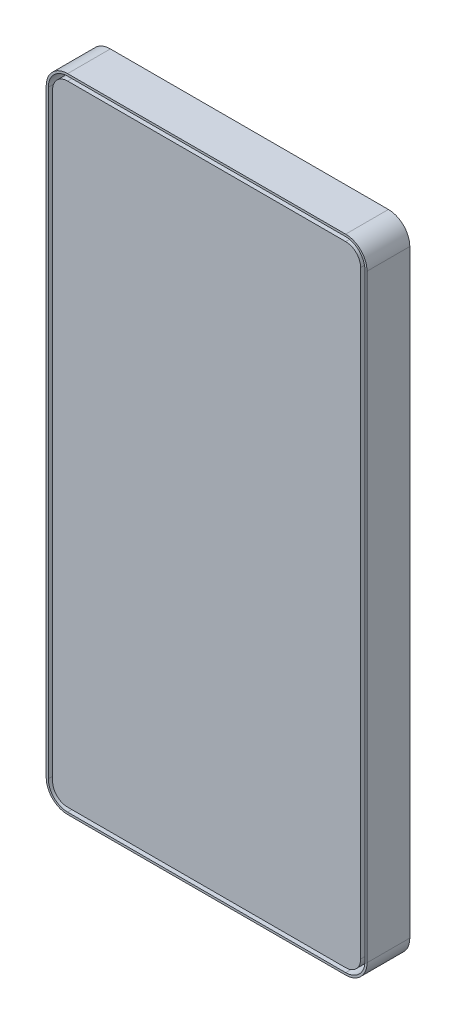
from build123d import *

# Parameters (mm, degrees)
EXTRUDE_1_DEPTH       = 10
EXTRUDE_2_DEPTH       = 3
CUT_EXTRUDE_1_DEPTH   = 1
CUT_EXTRUDE_1_2_DEPTH = 9
CUT_EXTRUDE_2_DEPTH   = 10
CUT_EXTRUDE_3_REACH   = 156.94


with BuildPart() as part:
    # 草图1 → 凸台-拉伸1 (new body)
    with BuildSketch(Plane.XY):
        with BuildLine():
            Line((-32.5, -75), (32.5, -75))
            ThreePointArc((32.5, -75), (36.035533906, -73.535533906), (37.5, -70))
            Line((37.5, -70), (37.5, 70))
            ThreePointArc((37.5, 70), (36.035533906, 73.535533906), (32.5, 75))
            Line((32.5, 75), (-32.5, 75))
            ThreePointArc((-32.5, 75), (-36.035533906, 73.535533906), (-37.5, 70))
            Line((-37.5, 70), (-37.5, -70))
            ThreePointArc((-37.5, -70), (-36.035533906, -73.535533906), (-32.5, -75))
        make_face()
    extrude(amount=EXTRUDE_1_DEPTH)

    # 草图2 → 凸台-拉伸2 (add)
    with BuildSketch(Plane(origin=(0, 0, 0), x_dir=(-1, 0, 0), z_dir=(0, 0, -1))):
        with BuildLine():
            Line((-29.5, 22), (10.5, 22))
            ThreePointArc((10.5, 22), (14.035533906, 23.464466094), (15.5, 27))
            Line((15.5, 27), (15.5, 67))
            ThreePointArc((15.5, 67), (14.035533906, 70.535533906), (10.5, 72))
            Line((10.5, 72), (-29.5, 72))
            ThreePointArc((-29.5, 72), (-33.035533906, 70.535533906), (-34.5, 67))
            Line((-34.5, 67), (-34.5, 27))
            ThreePointArc((-34.5, 27), (-33.035533906, 23.464466094), (-29.5, 22))
        make_face()
    extrude(amount=EXTRUDE_2_DEPTH)

    # 草图3 → Cut-Extrude 1 (cut)
    with BuildSketch(Plane(origin=(0, 0, -3), x_dir=(-1, 0, 0), z_dir=(0, 0, -1))):
        with BuildLine():
            Line((12.5, 27), (12.5, 67))
            ThreePointArc((12.5, 67), (11.914213562, 68.414213562), (10.5, 69))
            Line((10.5, 69), (-29.5, 69))
            ThreePointArc((-29.5, 69), (-30.914213562, 68.414213562), (-31.5, 67))
            Line((-31.5, 67), (-31.5, 27))
            ThreePointArc((-31.5, 27), (-30.914213562, 25.585786438), (-29.5, 25))
            Line((-29.5, 25), (10.5, 25))
            ThreePointArc((10.5, 25), (11.914213562, 25.585786438), (12.5, 27))
        make_face()
    extrude(amount=-CUT_EXTRUDE_1_DEPTH, mode=Mode.SUBTRACT)

    # 草图5 → Cut-Extrude 1 2 (cut)
    with BuildSketch(Plane.XY.offset(10)):
        with BuildLine():
            Line((-32.5, -74.5), (32.5, -74.5))
            ThreePointArc((32.5, -74.5), (35.681980515, -73.181980515), (37, -70))
            Line((37, -70), (37, 70))
            ThreePointArc((37, 70), (35.681980515, 73.181980515), (32.5, 74.5))
            Line((32.5, 74.5), (-32.5, 74.5))
            ThreePointArc((-32.5, 74.5), (-35.681980515, 73.181980515), (-37, 70))
            Line((-37, 70), (-37, -70))
            ThreePointArc((-37, -70), (-35.681980515, -73.181980515), (-32.5, -74.5))
        make_face()
        with BuildLine():
            Line((-32.5, -73.5), (32.5, -73.5))
            ThreePointArc((32.5, -73.5), (34.974873734, -72.474873734), (36, -70))
            Line((36, -70), (36, 70))
            ThreePointArc((36, 70), (34.974873734, 72.474873734), (32.5, 73.5))
            Line((32.5, 73.5), (-32.5, 73.5))
            ThreePointArc((-32.5, 73.5), (-34.974873734, 72.474873734), (-36, 70))
            Line((-36, 70), (-36, -70))
            ThreePointArc((-36, -70), (-34.974873734, -72.474873734), (-32.5, -73.5))
        make_face(mode=Mode.SUBTRACT)
    extrude(amount=-CUT_EXTRUDE_1_2_DEPTH, mode=Mode.SUBTRACT)

    # 草图6 → 切除-拉伸2 (cut)
    with BuildSketch(Plane.XZ.offset(75)):
        with BuildLine():
            Line((-3.5, 6), (3.5, 6))
            ThreePointArc((3.5, 6), (4.5, 5), (3.5, 4))
            Line((3.5, 4), (-3.5, 4))
            ThreePointArc((-3.5, 4), (-4.5, 5), (-3.5, 6))
        make_face()
    extrude(amount=-CUT_EXTRUDE_2_DEPTH, mode=Mode.SUBTRACT)

    # 草图7 → 切除-拉伸3 (cut, up to next)
    with BuildSketch(Plane.XZ.offset(75), mode=Mode.PRIVATE) as cut_extrude_3_sk1:
        with BuildLine():
            Line((-3.5, 1.5), (3.5, 1.5))
            ThreePointArc((3.5, 1.5), (7, 5), (3.5, 8.5))
            Line((3.5, 8.5), (-3.5, 8.5))
            ThreePointArc((-3.5, 8.5), (-7, 5), (-3.5, 1.5))
        make_face()
    cut_extrude_3_tool1 = extrude(cut_extrude_3_sk1.sketch, amount=-CUT_EXTRUDE_3_REACH, mode=Mode.PRIVATE) & part.part
    add(cut_extrude_3_tool1.solids().sort_by_distance((0, -75, 5))[0], mode=Mode.SUBTRACT)


solid = part.part
